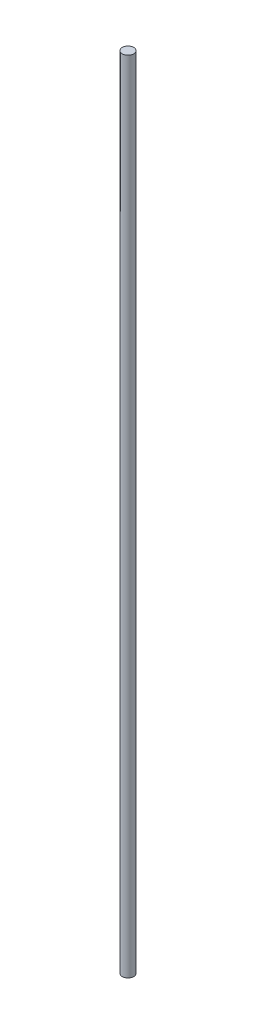
from build123d import *

# Parameters (mm, degrees)
SKETCH1_R           = 1.5875
BOSS_EXTRUDE1_DEPTH = 224.08388


with BuildPart() as part:
    # Sketch1 → Boss-Extrude1 (new body)
    with BuildSketch(Plane(origin=(0, 0, 0), x_dir=(1, 0, 0), z_dir=(0, 1, 0))):
        with Locations(Location((0, 0, 0), (0, 0, 270))):
            Circle(SKETCH1_R)
    extrude(amount=BOSS_EXTRUDE1_DEPTH)


solid = part.part
